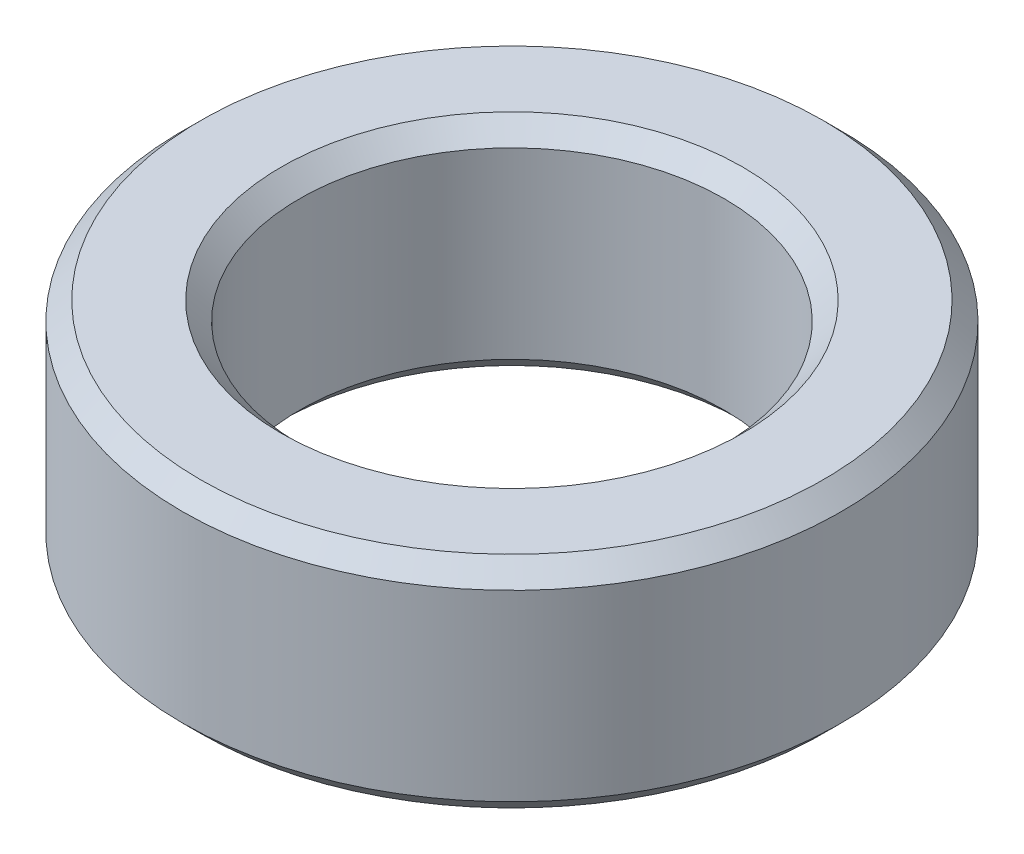
from build123d import *

# Parameters (mm, degrees)
SKETCH1_R           = 4.5
SKETCH1_R_2         = 2.9
BOSS_EXTRUDE1_DEPTH = 3
CHAMFER1_SIZE       = 0.25


with BuildPart() as part:
    # Sketch1 → Boss-Extrude1 (new body)
    with BuildSketch(Plane(origin=(0, 0, 0), x_dir=(1, 0, 0), z_dir=(0, 1, 0))):
        with Locations(Location((0, 0, 0), (0, 0, 270))):
            Circle(SKETCH1_R)
        with Locations(Location((0, 0, 0), (0, 0, 270))):
            Circle(SKETCH1_R_2, mode=Mode.SUBTRACT)
    extrude(amount=BOSS_EXTRUDE1_DEPTH)

    # Chamfer1
    chamfer1_edges = [part.edges().sort_by_distance(p)[0] for p in [
        (0, 0, -4.5),
        (0, 3, -4.5),
        (0, 0, -2.9),
        (0, 3, -2.9),
    ]]
    chamfer(chamfer1_edges, length=CHAMFER1_SIZE)


solid = part.part
